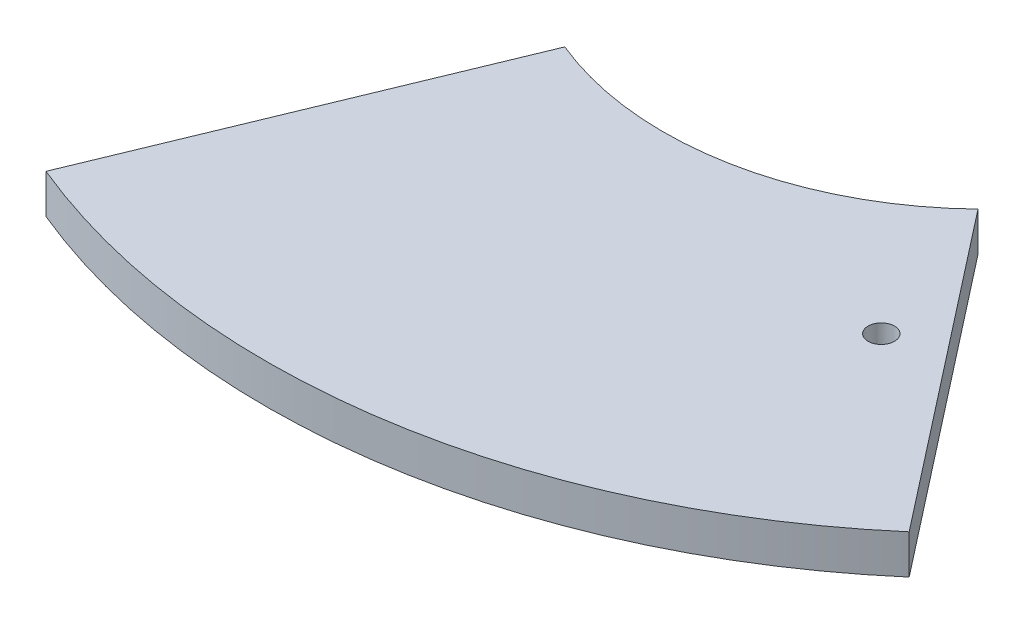
from build123d import *

# Parameters (mm, degrees)
SKETCH_1_R           = 210
EXTRUDE_1_DEPTH      = 10
SKETCH_2_R           = 75
CUT_EXTRUDE_1_DEPTH  = 10
SKETCH_4_R           = 82.197423103
CUT_EXTRUDE_3_DEPTH  = 10
SKETCH_5_R           = 232.576786868
SKETCH_5_R_2         = 183.037626036
CUT_EXTRUDE_4_DEPTH  = 10
CUT_EXTRUDE_6_DEPTH  = 10
CUT_EXTRUDE_7_DEPTH  = 10
EXTRUDE_2_DEPTH      = 10
SKETCH_8_R           = 3.37024185
CUT_EXTRUDE_9_DEPTH  = 10
EXTRUDE_START        = -10
EXTRUDE_3_DEPTH      = 10
SKETCH_10_R          = 221.118951793
SKETCH_10_R_2        = 189.34656242
CUT_EXTRUDE_10_DEPTH = 20
SKETCH_11_R          = 238.000555744
SKETCH_11_R_2        = 183.483177488
CUT_EXTRUDE_11_DEPTH = 20


with BuildPart() as part:
    # 草图1 → 凸台-拉伸1 (new body)
    with BuildSketch(Plane(origin=(0, 0, 0), x_dir=(1, 0, 0), z_dir=(0, 1, 0))):
        with Locations(Location((0, 0, 0), (0, 0, 270))):
            Circle(SKETCH_1_R)
    extrude(amount=EXTRUDE_1_DEPTH)

    # 草图2 → 切除-拉伸1 (cut)
    with BuildSketch(Plane(origin=(0, 10, 0), x_dir=(1, 0, 0), z_dir=(0, 1, 0))):
        with Locations(Location((0, 0, 0), (0, 0, 270))):
            Circle(SKETCH_2_R)
    extrude(amount=-CUT_EXTRUDE_1_DEPTH, mode=Mode.SUBTRACT)

    # 草图4 → 切除-拉伸3 (cut)
    with BuildSketch(Plane(origin=(0, 10, 0), x_dir=(1, 0, 0), z_dir=(0, 1, 0))):
        with Locations(Location((0, 0, 0), (0, 0, 270))):
            Circle(SKETCH_4_R)
    extrude(amount=-CUT_EXTRUDE_3_DEPTH, mode=Mode.SUBTRACT)

    # 草图5 → 切除-拉伸4 (cut)
    with BuildSketch(Plane(origin=(0, 10, 0), x_dir=(1, 0, 0), z_dir=(0, 1, 0))):
        Circle(SKETCH_5_R)
        with Locations(Location((0, 0, 0), (0, 0, 270))):
            Circle(SKETCH_5_R_2, mode=Mode.SUBTRACT)
    extrude(amount=-CUT_EXTRUDE_4_DEPTH, mode=Mode.SUBTRACT)

    # 草图3 → 切除-拉伸6 (cut)
    with BuildSketch(Plane(origin=(0, 10, 0), x_dir=(1, 0, 0), z_dir=(0, 1, 0))):
        Polygon((-218.107078413, -133.413550562), (-168.78547064, -202.149571439), (-50, -50), (50, -50), (168.78547064, -202.149571439), (64.609548257, -313.747882065), (267.248585971, -202.149571439), (429.751389162, 108.172046702), (-16.641853339, 302.979624022), (-278.723850855, 176.468454352), align=None)
    extrude(amount=-CUT_EXTRUDE_6_DEPTH, mode=Mode.SUBTRACT)

    # 草图6 → 切除-拉伸7 (cut)
    with BuildSketch(Plane(origin=(0, 10, 0), x_dir=(1, 0, 0), z_dir=(0, 1, 0))):
        Polygon((0, 0), (0, -233.405297089), (-177.211837764, -160.795172893), (-110.712466595, -38.220656306), align=None)
    extrude(amount=-CUT_EXTRUDE_7_DEPTH, mode=Mode.SUBTRACT)

    # 草图7 → 凸台-拉伸2 (add)
    with BuildSketch(Plane(origin=(0, 10, 0), x_dir=(1, 0, 0), z_dir=(0, 1, 0))):
        with BuildLine():
            Line((0, -131.161321566), (0, -190))
            ThreePointArc((0, -190), (65.897168622, -178.206518308), (123.6137367, -144.290138606))
            Line((123.6137367, -144.290138606), (94.010463478, -106.371988266))
            Line((94.010463478, -106.371988266), (0, -131.161321566))
        make_face()
    extrude(amount=-EXTRUDE_2_DEPTH)

    # 草图8 → 切除-拉伸9 (cut)
    with BuildSketch(Plane(origin=(0, 10, 0), x_dir=(1, 0, 0), z_dir=(0, 1, 0))):
        with Locations(Location((72.297266291, -98.948546348, 0), (0, 0, 270))):
            Circle(SKETCH_8_R)
    extrude(amount=-CUT_EXTRUDE_9_DEPTH, mode=Mode.SUBTRACT)

    # 草图9 → 凸台-拉伸3 (add)
    with BuildSketch(Plane.XZ.offset(EXTRUDE_START)):
        with BuildLine():
            Line((-72.52965516, 175.611642901), (-31.37763554, 75.972760596))
            ThreePointArc((-31.37763554, 75.972760596), (-15.994549348, 80.626241112), (0, 82.197423103))
            Line((0, 82.197423103), (0, 190))
            ThreePointArc((0, 190), (-36.971528565, 186.36820028), (-72.52965516, 175.611642901))
        make_face()
    extrude(amount=EXTRUDE_3_DEPTH)

    # 草图10 → 切除-拉伸10 (cut)
    with BuildSketch(Plane.XZ):
        with Locations((6.928171241, 3.379528268)):
            Circle(SKETCH_10_R)
        Circle(SKETCH_10_R_2, mode=Mode.SUBTRACT)
    extrude(amount=-CUT_EXTRUDE_10_DEPTH, mode=Mode.SUBTRACT)

    # 草图11 → 切除-拉伸11 (cut)
    with BuildSketch(Plane.XZ):
        with Locations((0, 17.732727097)):
            Circle(SKETCH_11_R)
        Circle(SKETCH_11_R_2, mode=Mode.SUBTRACT)
    extrude(amount=-CUT_EXTRUDE_11_DEPTH, mode=Mode.SUBTRACT)


solid = part.part
